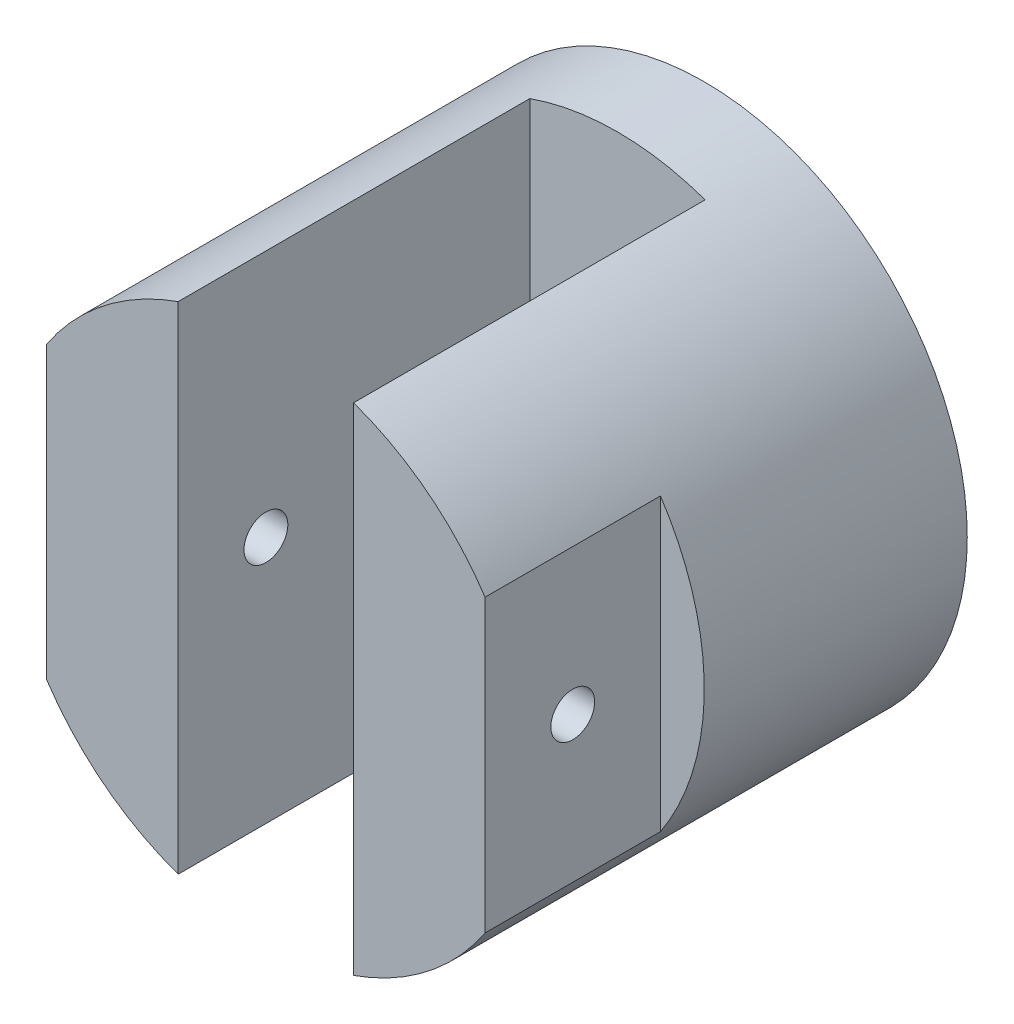
from build123d import *

# Parameters (mm, degrees)
SKETCH1_R                                = 38.1
OD_DON_T_CARE_DEPTH                      = 63.5
SKETCH2_R                                = 3.175
F_2X_1_4_THROUGH_HOLE_DEPTH              = 50.8
SKETCH3_W                                = 25.4
SKETCH3_H                                = 50.927
SLOT_DEPTH                               = 50.8
SKETCH4_R                                = 7.9375
F_5_8_THROUGH_HOLE_DEPTH                 = 75.140268103
SKETCH5_OUTSIDE_W                        = 103.216
SKETCH5_OUTSIDE_H                        = 103.216
SKETCH5_OUTSIDE_W_2                      = 63.5
SKETCH5_OUTSIDE_H_2                      = 71.842048968
FLAT_SURFACE_FOR_3_4_LONG_SHOULDER_DEPTH = 25.4


with BuildPart() as part:
    # Sketch1 → OD Don't Care (new body)
    with BuildSketch(Plane.XY):
        Circle(SKETCH1_R)
    extrude(amount=OD_DON_T_CARE_DEPTH)

    # Sketch2 → 2x 1/4" Through Hole (cut, symmetric)
    with BuildSketch(Plane(origin=(0, 0, 0), x_dir=(0, 0, -1), z_dir=(1, 0, 0))):
        with Locations(Location((-50.8, 0, 0), (0, 0, 180))):
            Circle(SKETCH2_R)
    extrude(amount=F_2X_1_4_THROUGH_HOLE_DEPTH, both=True, mode=Mode.SUBTRACT)

    # Sketch3 → Slot (cut, symmetric)
    with BuildSketch(Plane(origin=(0, 0, 0), x_dir=(1, 0, 0), z_dir=(0, 1, 0))):
        with Locations((0, -38.0365)):
            Rectangle(SKETCH3_W, SKETCH3_H)
    extrude(amount=SLOT_DEPTH, both=True, mode=Mode.SUBTRACT)

    # Sketch4 → 5/8" Through Hole (cut, through all)
    with BuildSketch(Plane.XY.offset(12.573)):
        Circle(SKETCH4_R)
    extrude(amount=-F_5_8_THROUGH_HOLE_DEPTH, mode=Mode.SUBTRACT)

    # Sketch5 outside → Flat Surface for 3/4" Long Shoulder (cut)
    with BuildSketch(Plane.XY.offset(63.5)):
        Rectangle(SKETCH5_OUTSIDE_W, SKETCH5_OUTSIDE_H)
        Rectangle(SKETCH5_OUTSIDE_W_2, SKETCH5_OUTSIDE_H_2, mode=Mode.SUBTRACT)
    extrude(amount=-FLAT_SURFACE_FOR_3_4_LONG_SHOULDER_DEPTH, mode=Mode.SUBTRACT)


solid = part.part
